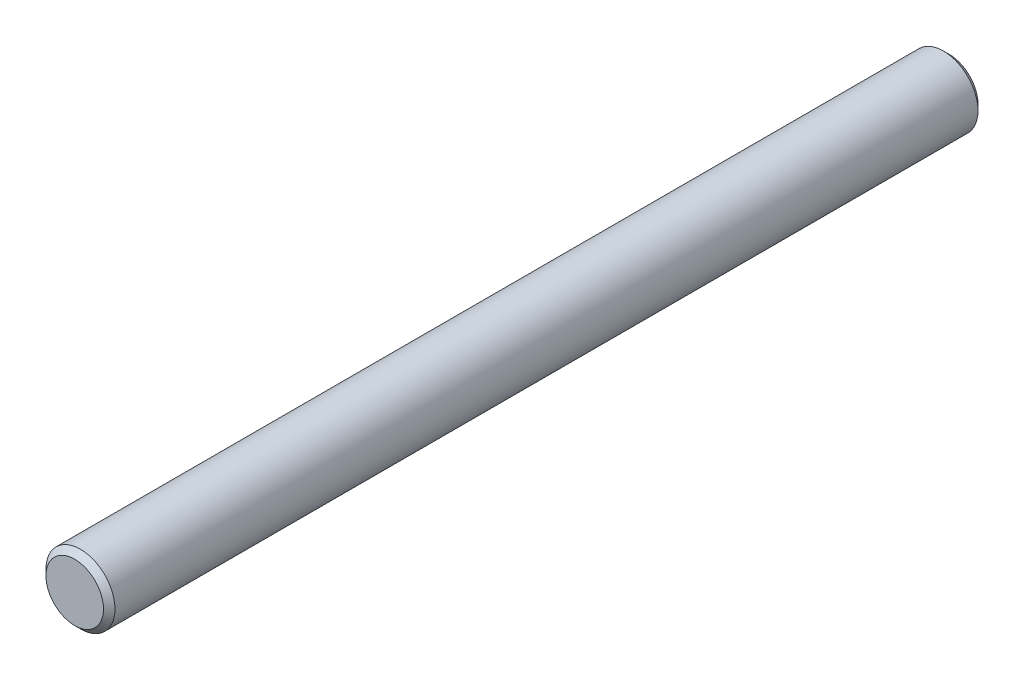
from build123d import *

# Parameters (mm, degrees)
ESQUISSE1_R        = 1.5
BOSS_EXTRU_1_DEPTH = 38
CHANFREIN1_SIZE    = 0.25


with BuildPart() as part:
    # Esquisse1 → Boss.-Extru.1 (new body)
    with BuildSketch(Plane.XY):
        Circle(ESQUISSE1_R)
    extrude(amount=BOSS_EXTRU_1_DEPTH)

    # Chanfrein1
    chanfrein1_edges = [part.edges().sort_by_distance(p)[0] for p in [
        (-1.5, 0, 0),
        (-1.5, 0, 38),
    ]]
    chamfer(chanfrein1_edges, length=CHANFREIN1_SIZE)


solid = part.part
